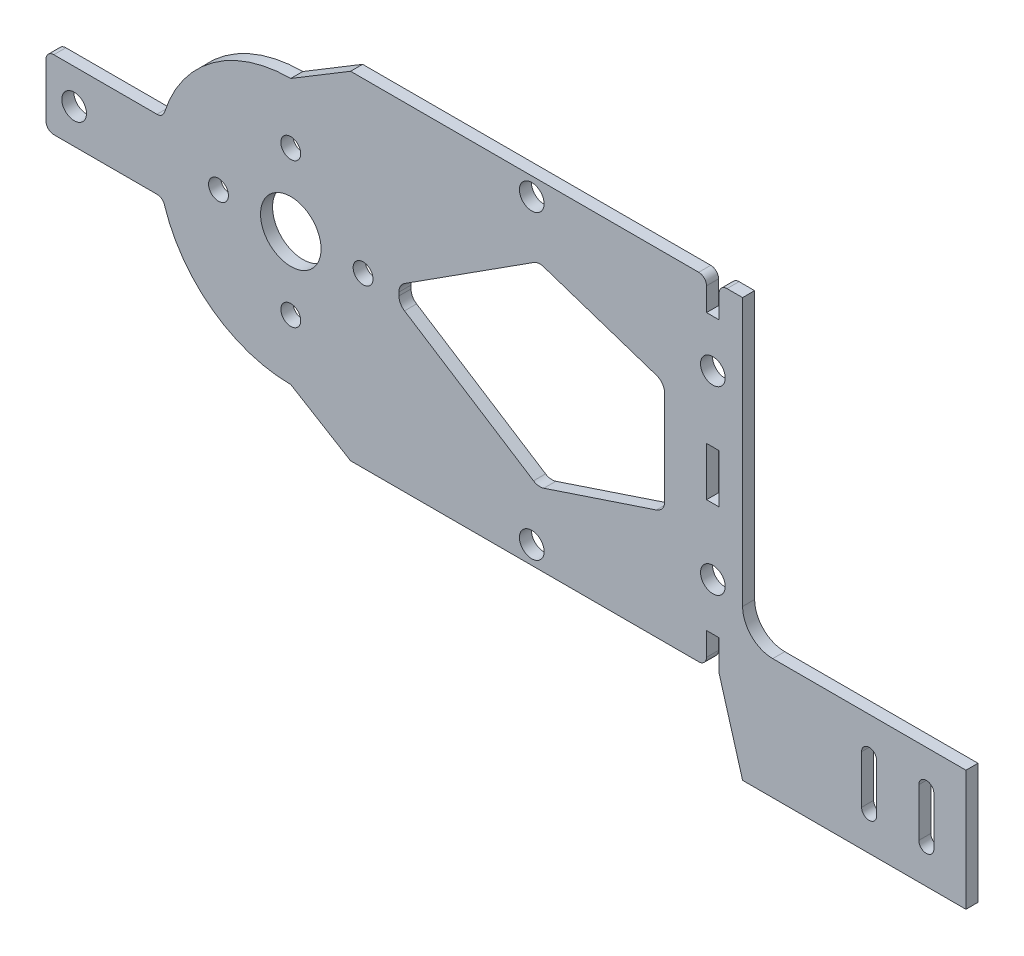
from build123d import *

# Parameters (mm, degrees)
SKETCH_1_R      = 2.05
SKETCH_1_R_2    = 5.025
SKETCH_1_R_3    = 1.65
SKETCH_1_W      = 2.1
SKETCH_1_H      = 8.1
EXTRUDE_1_DEPTH = 2
FILLET_1_R      = 1.3
FILLET_2_R      = 2
FILLET_3_R      = 5


with BuildPart() as part:
    # 草图1 → 凸台-拉伸1 (new body)
    with BuildSketch(Plane.XY):
        with BuildLine():
            Line((32.115707856, 28), (32.115707856, 22.85))
            Line((32.115707856, 22.85), (30.015707856, 22.85))
            Line((30.015707856, 22.85), (30.015707856, 28))
            Line((30.015707856, 28), (-29.075, 28))
            Line((-29.075, 28), (-38.998995168, 22.002009663))
            ThreePointArc((-38.998995168, 22.002009663), (-52.370174504, 17.472835843), (-60.236366221, 5.75))
            Line((-60.236366221, 5.75), (-79.631279411, 5.75))
            Line((-79.631279411, 5.75), (-79.631279411, -5.75))
            Line((-79.631279411, -5.75), (-60.236366221, -5.75))
            ThreePointArc((-60.236366221, -5.75), (-52.370174504, -17.472835843), (-38.998995168, -22.002009663))
            Line((-38.998995168, -22.002009663), (-29.075, -28))
            Line((-29.075, -28), (30.015707856, -28))
            Line((30.015707856, -28), (30.015707856, -22.85))
            Line((30.015707856, -22.85), (32.115707856, -22.85))
            Line((32.115707856, -22.85), (32.115707856, -28))
            Line((32.115707856, -28), (36.001004832, -41.401911511))
            Line((36.001004832, -41.401911511), (73.077470353, -41.401911511))
            Line((73.077470353, -41.401911511), (73.077470353, -21.401911511))
            Line((73.077470353, -21.401911511), (36.001004832, -21.401911511))
            Line((36.001004832, -21.401911511), (36.001004832, 28))
            Line((36.001004832, 28), (32.115707856, 28))
        make_face()
        with Locations((31.065707856, 15)):
            Circle(SKETCH_1_R, mode=Mode.SUBTRACT)
        with Locations(Location((31.065707856, -15, 0), (0, 0, 180))):
            Circle(SKETCH_1_R, mode=Mode.SUBTRACT)
        with Locations((-38.998995168, 0)):
            Circle(SKETCH_1_R_2, mode=Mode.SUBTRACT)
        with Locations((1.001004832, -25)):
            Circle(SKETCH_1_R, mode=Mode.SUBTRACT)
        with Locations((1.001004832, 25)):
            Circle(SKETCH_1_R, mode=Mode.SUBTRACT)
        with Locations((-74.958287312, 0)):
            Circle(SKETCH_1_R, mode=Mode.SUBTRACT)
        with Locations((-50.998995168, 0)):
            Circle(SKETCH_1_R_3, mode=Mode.SUBTRACT)
        with Locations((-38.998995168, 12)):
            Circle(SKETCH_1_R_3, mode=Mode.SUBTRACT)
        with Locations((-26.998995168, 0)):
            Circle(SKETCH_1_R_3, mode=Mode.SUBTRACT)
        with Locations((-38.998995168, -12)):
            Circle(SKETCH_1_R_3, mode=Mode.SUBTRACT)
        with Locations((31.065707856, 0)):
            Rectangle(SKETCH_1_W, SKETCH_1_H, mode=Mode.SUBTRACT)
        Polygon((2.100885183, -16.20323489), (23.065707856, -9.230000311), (23.065707856, 9.230000311), (2.100885183, 16.20323489), (-21.039703025, 1.3748119), (-21.039703025, -1.3748119), align=None, mode=Mode.SUBTRACT)
        with BuildLine():
            Line((55.751004832, -35.401911511), (55.751004832, -27.401911511))
            ThreePointArc((55.751004832, -27.401911511), (57.001004832, -26.151911511), (58.251004832, -27.401911511))
            Line((58.251004832, -27.401911511), (58.251004832, -35.401911511))
            ThreePointArc((58.251004832, -35.401911511), (57.001004832, -36.651911511), (55.751004832, -35.401911511))
        make_face(mode=Mode.SUBTRACT)
        with BuildLine():
            Line((67.751004832, -27.401911511), (67.751004832, -35.401911511))
            ThreePointArc((67.751004832, -35.401911511), (66.501004832, -36.651911511), (65.251004832, -35.401911511))
            Line((65.251004832, -35.401911511), (65.251004832, -27.401911511))
            ThreePointArc((65.251004832, -27.401911511), (66.501004832, -26.151911511), (67.751004832, -27.401911511))
        make_face(mode=Mode.SUBTRACT)
    extrude(amount=EXTRUDE_1_DEPTH)

    # 圆角1
    fillet_1_edges = [part.edges().sort_by_distance(p)[0] for p in [
        (-60.236366221, -5.75, 1),
        (-79.631279411, -5.75, 1),
        (-79.631279411, 5.75, 1),
        (-60.236366221, 5.75, 1),
        (30.015707856, 28, 1),
        (32.115707856, 28, 1),
        (30.015707856, -28, 1),
    ]]
    fillet(fillet_1_edges, radius=FILLET_1_R)

    # 圆角2
    fillet_2_edges = [part.edges().sort_by_distance(p)[0] for p in [
        (2.100885183, -16.20323489, 1),
        (23.065707856, -9.230000311, 1),
        (23.065707856, 9.230000311, 1),
        (2.100885183, 16.20323489, 1),
        (-21.039703025, 1.3748119, 1),
        (-21.039703025, -1.3748119, 1),
    ]]
    fillet(fillet_2_edges, radius=FILLET_2_R)

    # 圆角3
    fillet_3_edges = [part.edges().sort_by_distance(p)[0] for p in [
        (36.001004832, -21.401911511, 1),
    ]]
    fillet(fillet_3_edges, radius=FILLET_3_R)


solid = part.part
